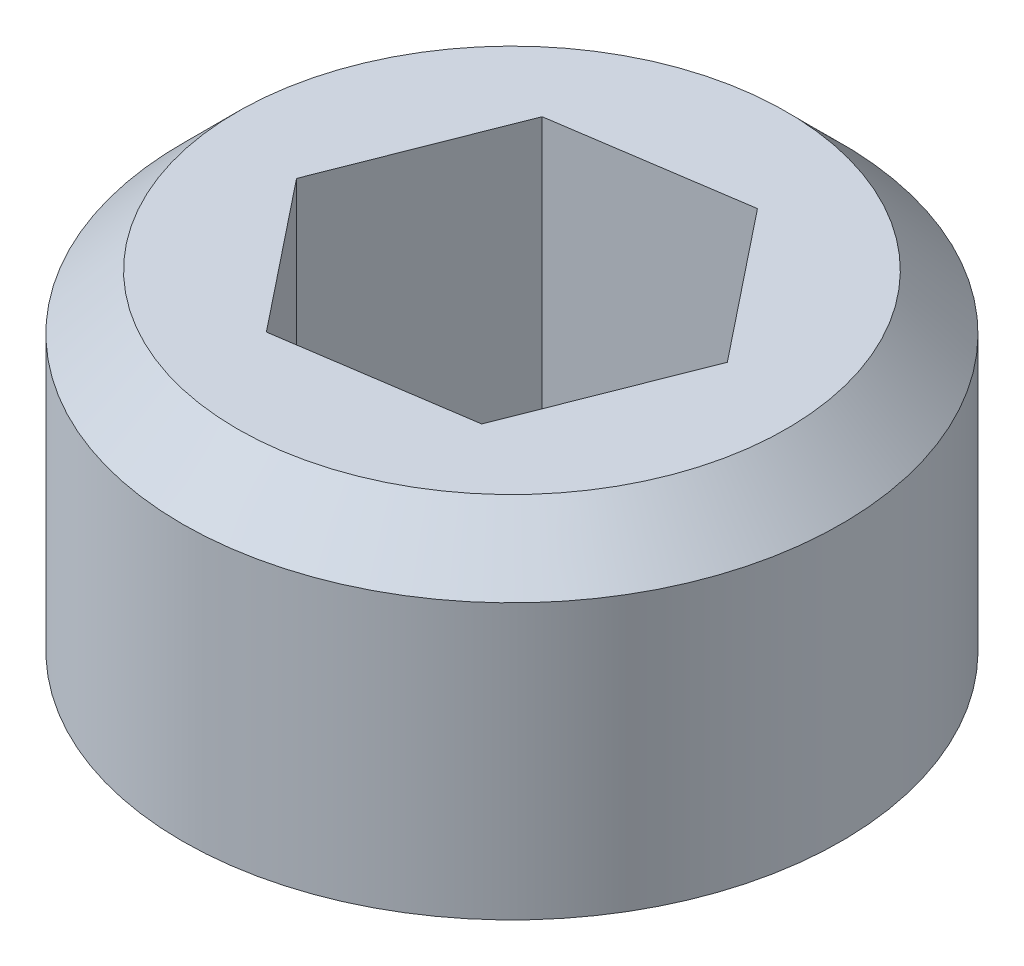
from build123d import *

# Parameters (mm, degrees)
SKETCH_1_R          = 6
EXTRUDE_1_DEPTH     = 6
CUT_EXTRUDE_1_DEPTH = 5
CHAMFER_1_SIZE      = 1


with BuildPart() as part:
    # 草图1 → 凸台-拉伸1 (new body)
    with BuildSketch(Plane(origin=(0, 0, 0), x_dir=(1, 0, 0), z_dir=(0, 1, 0))):
        with Locations(Location((0, 0, 0), (0, 0, 270))):
            Circle(SKETCH_1_R)
    extrude(amount=EXTRUDE_1_DEPTH)

    # 草图2 → 切除-拉伸1 (cut)
    with BuildSketch(Plane(origin=(0, 6, 0), x_dir=(1, 0, 0), z_dir=(0, 1, 0))):
        Polygon((1.261535508, 3.20868814), (-2.148037688, 2.696865868), (-3.409573196, -0.511822272), (-1.261535508, -3.20868814), (2.148037688, -2.696865868), (3.409573196, 0.511822272), align=None)
    extrude(amount=-CUT_EXTRUDE_1_DEPTH, mode=Mode.SUBTRACT)

    # 倒角1
    chamfer_1_edges = [part.edges().sort_by_distance(p)[0] for p in [
        (0, 6, -6),
    ]]
    chamfer(chamfer_1_edges, length=CHAMFER_1_SIZE)


solid = part.part
